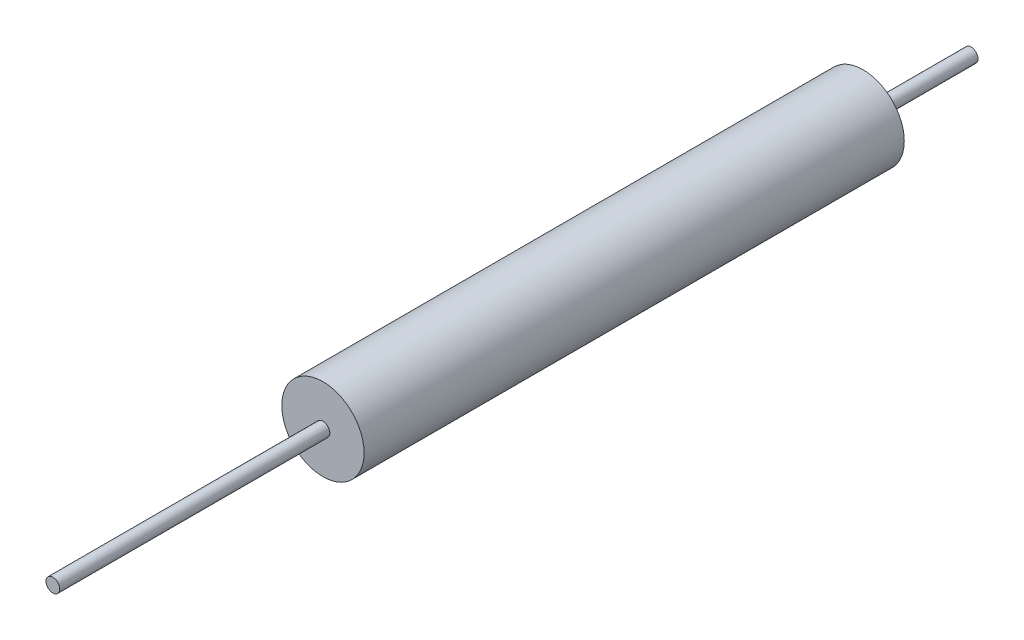
from build123d import *

# Parameters (mm, degrees)
CROQUIS1_R              = 19.05
SALIENTE_EXTRUIR1_DEPTH = 250
CROQUIS2_R              = 3.175
SALIENTE_EXTRUIR2_DEPTH = 50
SALIENTE_EXTRUIR3_START = 125
CROQUIS3_R              = 3.175
SALIENTE_EXTRUIR3_DEPTH = 125


with BuildPart() as part:
    # Croquis1 → Saliente-Extruir1 (new body)
    with BuildSketch(Plane.XY):
        Circle(CROQUIS1_R)
    extrude(amount=SALIENTE_EXTRUIR1_DEPTH)

    # Croquis2 → Saliente-Extruir2 (add)
    with BuildSketch(Plane(origin=(0, 0, 0), x_dir=(-1, 0, 0), z_dir=(0, 0, -1))):
        Circle(CROQUIS2_R)
    extrude(amount=SALIENTE_EXTRUIR2_DEPTH)

    # Croquis3 → Saliente-Extruir3 (add)
    with BuildSketch(Plane.XY.offset(250).offset(SALIENTE_EXTRUIR3_START)):
        with Locations(Location((0, 0, 0), (0, 0, 180))):
            Circle(CROQUIS3_R)
    extrude(amount=-SALIENTE_EXTRUIR3_DEPTH)


solid = part.part
